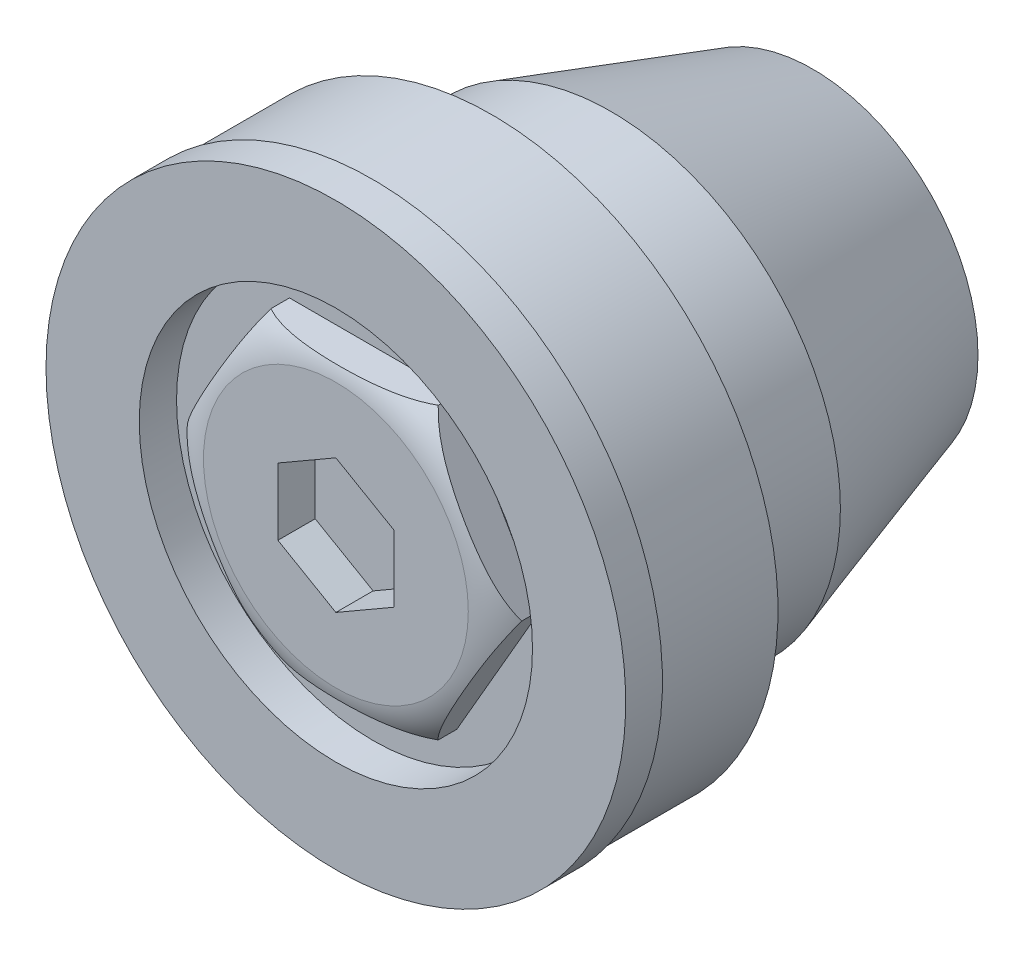
from build123d import *

# Parameters (mm, degrees)
SKETCH2_R          = 5.7
CUT_EXTRUDE1_DEPTH = 17.78
SKETCH3_R          = 10.717201778
CUT_EXTRUDE2_DEPTH = 2.032
CUT_EXTRUDE3_DEPTH = 2.032


with BuildPart() as part:
    # Sketch1 → Revolve1 (revolve)
    with BuildSketch(Plane(origin=(0, 0, 0), x_dir=(0, 0, -1), z_dir=(1, 0, 0)), mode=Mode.PRIVATE) as revolve1_sk:
        Polygon((0, 0), (0, 15.800000023), (2, 15.800000023), (2, 15.600000023), (8.5, 15.600000023), (8.5, 12.5), (15, 12.5), (26, 9), (26, 0), align=None)
    revolve(revolve1_sk.sketch.rotate(Axis((0, 0, 0), (0, 0, 1)), 90), axis=Axis((0, 0, 0), (0, 0, 1)))

    # Sketch2 → Cut-Extrude1 (cut)
    with BuildSketch(Plane(origin=(0, 0, -26), x_dir=(-1, 0, 0), z_dir=(0, 0, -1))):
        Circle(SKETCH2_R)
    extrude(amount=-CUT_EXTRUDE1_DEPTH, mode=Mode.SUBTRACT)

    # Sketch3 → Cut-Extrude2 (cut)
    with BuildSketch(Plane.XY):
        Circle(SKETCH3_R)
        Polygon((4.561067127, 7.9), (-4.561067127, 7.9), (-9.122134253, 0), (-4.561067127, -7.9), (4.561067127, -7.9), (9.122134253, 0), align=None, mode=Mode.SUBTRACT)
    extrude(amount=-CUT_EXTRUDE2_DEPTH, mode=Mode.SUBTRACT)

    # Sketch4 → Cut-Revolve1 (revolve, cut)
    with BuildSketch(Plane(origin=(0, 0, 0), x_dir=(1, 0, 0), z_dir=(0, 1, 0)), mode=Mode.PRIVATE) as cut_revolve1_sk:
        with BuildLine():
            Line((-9.122134253, 1.016), (-9.122134253, 0))
            Line((-9.122134253, 0), (-7.217734963, 0))
            ThreePointArc((-7.217734963, 0), (-8.258276499, 0.342411186), (-9.122134253, 1.016))
        make_face()
    revolve(cut_revolve1_sk.sketch.rotate(Axis((0, 0, 0), (0, 0, -1)), 180), axis=Axis((0, 0, 0), (0, 0, -1)), mode=Mode.SUBTRACT)

    # Sketch5 → Cut-Extrude3 (cut)
    with BuildSketch(Plane.XY):
        Polygon((0, 3.648853701), (-3.16, 1.824426851), (-3.16, -1.824426851), (0, -3.648853701), (3.16, -1.824426851), (3.16, 1.824426851), align=None)
    extrude(amount=-CUT_EXTRUDE3_DEPTH, mode=Mode.SUBTRACT)


solid = part.part
